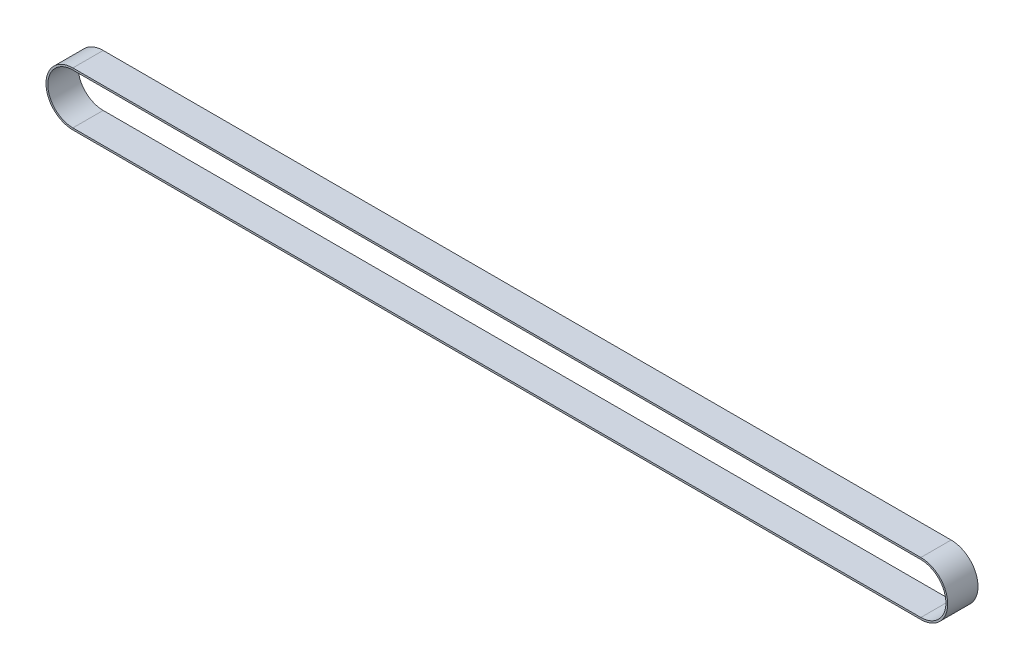
from build123d import *

# Parameters (mm, degrees)
EXTRUDE_1_DEPTH = 25


with BuildPart() as part:
    # 草图1 → 拉伸-薄壁1 (new body)
    with BuildSketch(Plane.XY):
        with BuildLine():
            Line((700, -22.19), (0, -22.19))
            ThreePointArc((0, -22.19), (-22.19, 0), (0, 22.19))
            Line((0, 22.19), (700, 22.19))
            ThreePointArc((700, 22.19), (722.19, 0), (700, -22.19))
        make_face()
        with BuildLine():
            Line((700, -20.69), (0, -20.69))
            ThreePointArc((0, -20.69), (-20.69, 0), (0, 20.69))
            Line((0, 20.69), (700, 20.69))
            ThreePointArc((700, 20.69), (720.69, 0), (700, -20.69))
        make_face(mode=Mode.SUBTRACT)
    extrude(amount=EXTRUDE_1_DEPTH)


solid = part.part
